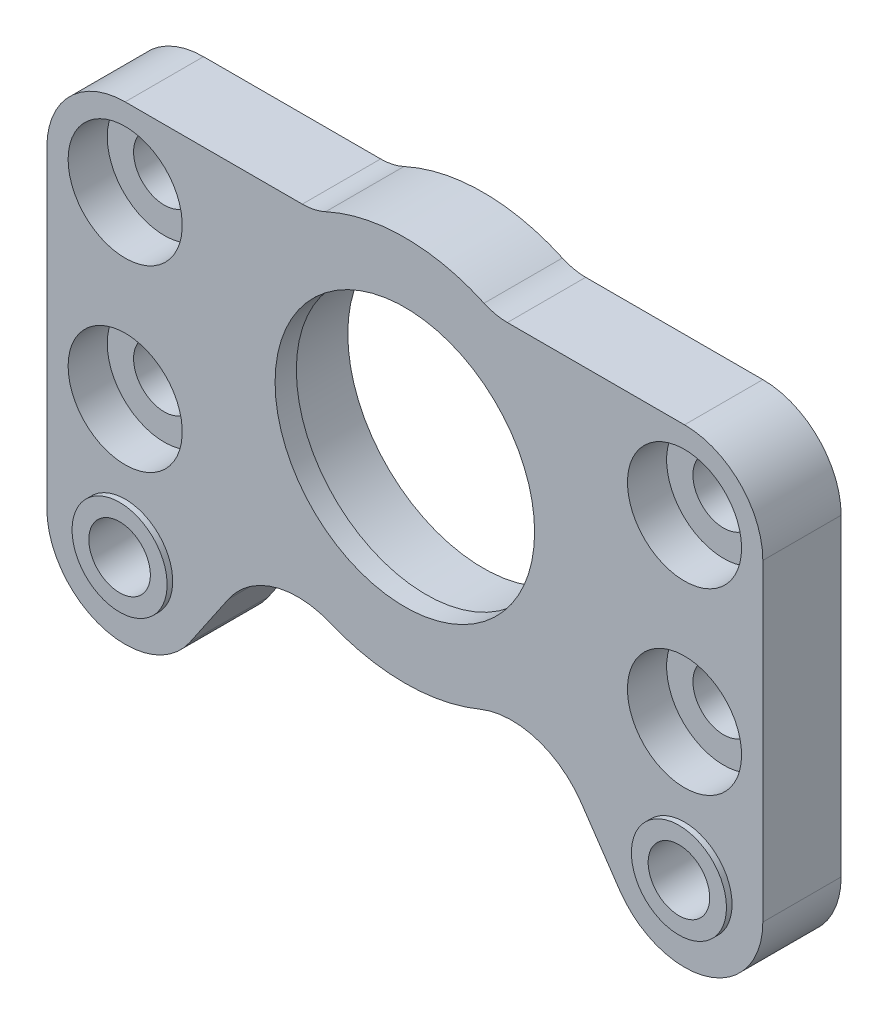
from build123d import *
from build123d.topology import SkipClean

# Parameters (mm, degrees)
BOSS_EXTRUDE1_DEPTH     = 7
CUT_EXTRUDE1_DEPTH      = 78.980769199
CUT_EXTRUDE1_DEPTH_BACK = 78.980769199
SKETCH3_R               = 2.75
SKETCH4_R               = 12.1
CUT_EXTRUDE2_DEPTH      = 5.1
BOSS_EXTRUDE2_START     = 0.5
SKETCH5_R               = 4.25
SKETCH5_R_2             = 2.75
BOSS_EXTRUDE2_DEPTH     = 0.5
SKETCH6_R               = 5.1
CUT_EXTRUDE3_DEPTH      = 3.5
FILLET1_R               = 5
CUT_EXTRUDE4_DEPTH      = 3.5


with BuildPart() as part:
    # Sketch1 → Boss-Extrude1 (new body)
    with BuildSketch(Plane.XY):
        with BuildLine():
            Line((64.000002369, 34.999998632), (64.000002369, 7.0000007))
            ThreePointArc((64.000002369, 7.0000007), (59.061035156, 0.310296383), (51.213675554, 3.060657863))
            Line((51.213675554, 3.060657863), (47.766721553, 8.123736451))
            ThreePointArc((47.766721553, 8.123736451), (43.713065604, 11.089441566), (38.696960231, 10.832108598))
            ThreePointArc((38.696960231, 10.832108598), (35.414081121, 9.836258221), (32.00000085, 9.5000007))
            Line((32.00000085, 9.5000007), (32.00000085, 15.4000007))
            ThreePointArc((32.00000085, 15.4000007), (43.60000085, 27.0000007), (32.00000085, 38.6000007))
            Line((32.00000085, 38.6000007), (32.00000085, 44.0000007))
            ThreePointArc((32.00000085, 44.0000007), (36.123106475, 43.492423203), (40.00000085, 42.0000007))
            Line((40.00000085, 42.0000007), (57.000002369, 42.0000007))
            ThreePointArc((57.000002369, 42.0000007), (61.9497513, 39.949747563), (64.000002369, 34.999998632))
        make_face()
    extrude(amount=BOSS_EXTRUDE1_DEPTH)

    # Sketch3 → Cut-Extrude1 (cut, two sides: drawn at the far end of the back side and taken through both)
    with BuildSketch(Plane.XY.offset(7).offset(-CUT_EXTRUDE1_DEPTH_BACK)):
        with Locations((56.999999697, 35.000001537)):
            Circle(SKETCH3_R)
        with Locations((56.999999697, 19.000001537)):
            Circle(SKETCH3_R)
        with Locations((56.999999697, 7.000001537)):
            Circle(SKETCH3_R)
    extrude(amount=CUT_EXTRUDE1_DEPTH + CUT_EXTRUDE1_DEPTH_BACK, mode=Mode.SUBTRACT)

    # Sketch4 → Cut-Extrude2 (cut)
    with BuildSketch(Plane(origin=(0, 0, 0), x_dir=(-1, 0, 0), z_dir=(0, 0, -1))):
        with Locations((-32.00000085, 27.0000007)):
            Circle(SKETCH4_R)
    extrude(amount=-CUT_EXTRUDE2_DEPTH, mode=Mode.SUBTRACT)

    # Sketch5 → Boss-Extrude2 (add)
    with BuildSketch(Plane.XY.offset(7).offset(BOSS_EXTRUDE2_START)):
        with Locations((56.999999697, 7.000001537)):
            Circle(SKETCH5_R)
        with Locations((56.999999697, 7.000001537)):
            Circle(SKETCH5_R_2, mode=Mode.SUBTRACT)
    extrude(amount=-BOSS_EXTRUDE2_DEPTH)

    # Sketch6 → Cut-Extrude3 (cut)
    with BuildSketch(Plane.XY.offset(7)):
        with Locations((56.999999697, 19.000001537)):
            Circle(SKETCH6_R)
        with Locations((56.999999697, 35.000001537)):
            Circle(SKETCH6_R)
    extrude(amount=-CUT_EXTRUDE3_DEPTH, mode=Mode.SUBTRACT)

    # Fillet1
    fillet1_edges = [part.edges().sort_by_distance(p)[0] for p in [
        (40.00000085, 42.0000007, 3.5),
    ]]
    fillet(fillet1_edges, radius=FILLET1_R)

    # Sketch8 → Cut-Extrude4 (cut)
    with BuildSketch(Plane(origin=(0, 0, 0), x_dir=(-1, 0, 0), z_dir=(0, 0, -1))):
        Polygon((-54.546261053, 11.250001537), (-59.453738341, 11.250001537), (-61.907476985, 7.000001537), (-59.453738341, 2.750001537), (-54.546261053, 2.750001537), (-52.092522409, 7.000001537), align=None)
    extrude(amount=-CUT_EXTRUDE4_DEPTH, mode=Mode.SUBTRACT)

    # Mirror2: part across plane


with BuildPart() as part_1:
    with SkipClean():  # the faces are left unmerged after this step: merging them gives an invalid solid
        add(part.part)
        add(part.part.mirror(Plane(origin=(32.00000085, 44.0000007, 7), x_dir=(0, 0, 1), z_dir=(1, 0, 0))))


solid = part_1.part
